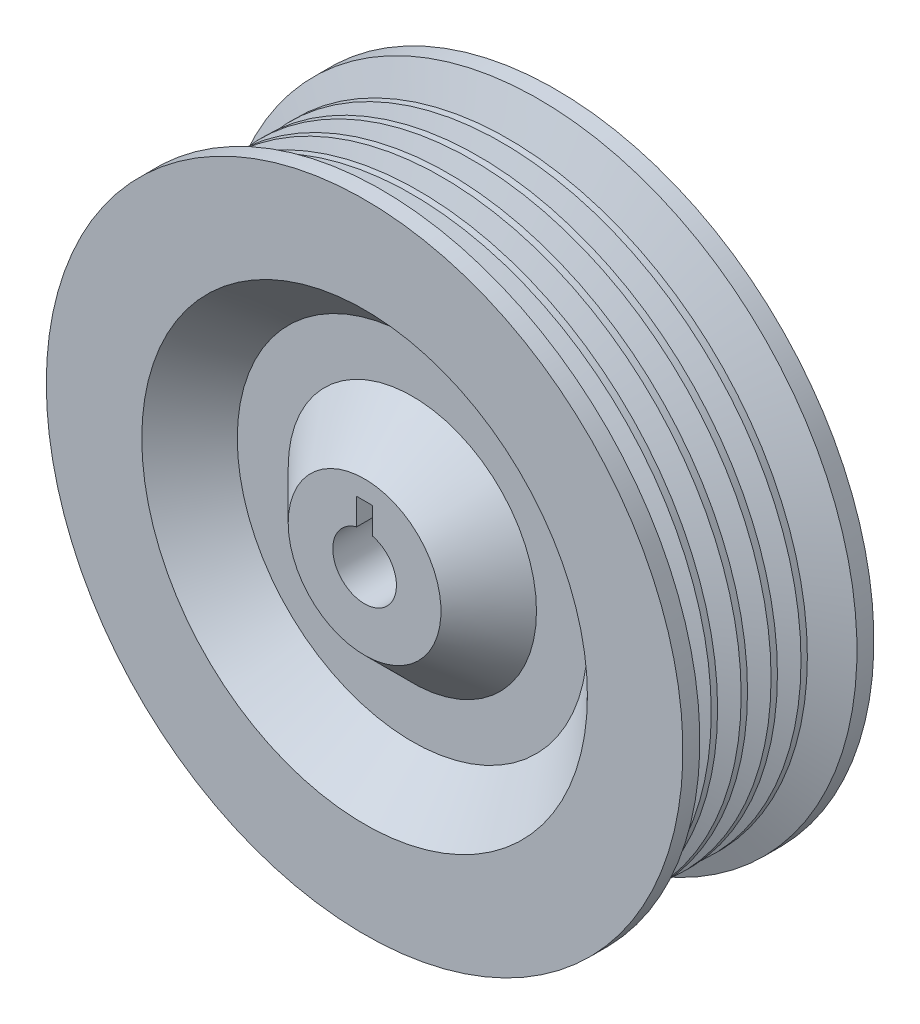
from build123d import *

# Parameters (mm, degrees)
CUT_EXTRUDE_1_DEPTH = 77.811457479


with BuildPart() as part:
    # Эскиз1 → Повернуть1 (revolve)
    with BuildSketch(Plane(origin=(0, 0, 0), x_dir=(0, 0, -1), z_dir=(1, 0, 0)), mode=Mode.PRIVATE) as revolve_1_sk:
        with BuildLine():
            Line((0, 0), (0, 12))
            Line((0, 12), (7.5, 19.5))
            Line((7.5, 19.5), (7.5, 27.5))
            Line((7.5, 27.5), (0, 35))
            Line((0, 35), (0, 50))
            Line((0, 50), (2.658089297, 50))
            Line((2.658089297, 50), (5.299298361, 42.743337736))
            ThreePointArc((5.299298361, 42.743337736), (5.6, 42.532784182), (5.900701639, 42.743337736))
            Line((5.900701639, 42.743337736), (7.45, 47))
            Line((7.45, 47), (8.45, 47))
            Line((8.45, 47), (9.999298361, 42.743337736))
            ThreePointArc((9.999298361, 42.743337736), (10.3, 42.532784182), (10.600701639, 42.743337736))
            Line((10.600701639, 42.743337736), (12.15, 47))
            Line((12.15, 47), (13.15, 47))
            Line((13.15, 47), (14.699298361, 42.743337736))
            ThreePointArc((14.699298361, 42.743337736), (15, 42.532784182), (15.300701639, 42.743337736))
            Line((15.300701639, 42.743337736), (16.85, 47))
            Line((16.85, 47), (17.85, 47))
            Line((17.85, 47), (19.399298361, 42.743337736))
            ThreePointArc((19.399298361, 42.743337736), (19.7, 42.532784182), (20.000701639, 42.743337736))
            Line((20.000701639, 42.743337736), (21.55, 47))
            Line((21.55, 47), (22.55, 47))
            Line((22.55, 47), (24.099298361, 42.743337736))
            ThreePointArc((24.099298361, 42.743337736), (24.4, 42.532784182), (24.700701639, 42.743337736))
            Line((24.700701639, 42.743337736), (27.341910703, 50))
            Line((27.341910703, 50), (30, 50))
            Line((30, 50), (30, 35))
            Line((30, 35), (22.5, 27.5))
            Line((22.5, 27.5), (22.5, 19.5))
            Line((22.5, 19.5), (30, 12))
            Line((30, 12), (30, 0))
            Line((30, 0), (0, 0))
        make_face()
    revolve(revolve_1_sk.sketch.rotate(Axis((0, 0, -30), (0, 0, 1)), 90), axis=Axis((0, 0, -30), (0, 0, 1)))

    # Эскиз2 → Вырез-Вытянуть1 (cut, through all)
    with BuildSketch(Plane(origin=(0, 0, -30), x_dir=(-1, 0, 0), z_dir=(0, 0, -1))):
        with BuildLine():
            Line((-1.25, 9), (-1.25, 4.841229183))
            ThreePointArc((-1.25, 4.841229183), (0, -5), (1.25, 4.841229183))
            Line((1.25, 4.841229183), (1.25, 9))
            Line((1.25, 9), (-1.25, 9))
        make_face()
    extrude(amount=-CUT_EXTRUDE_1_DEPTH, mode=Mode.SUBTRACT)


solid = part.part
